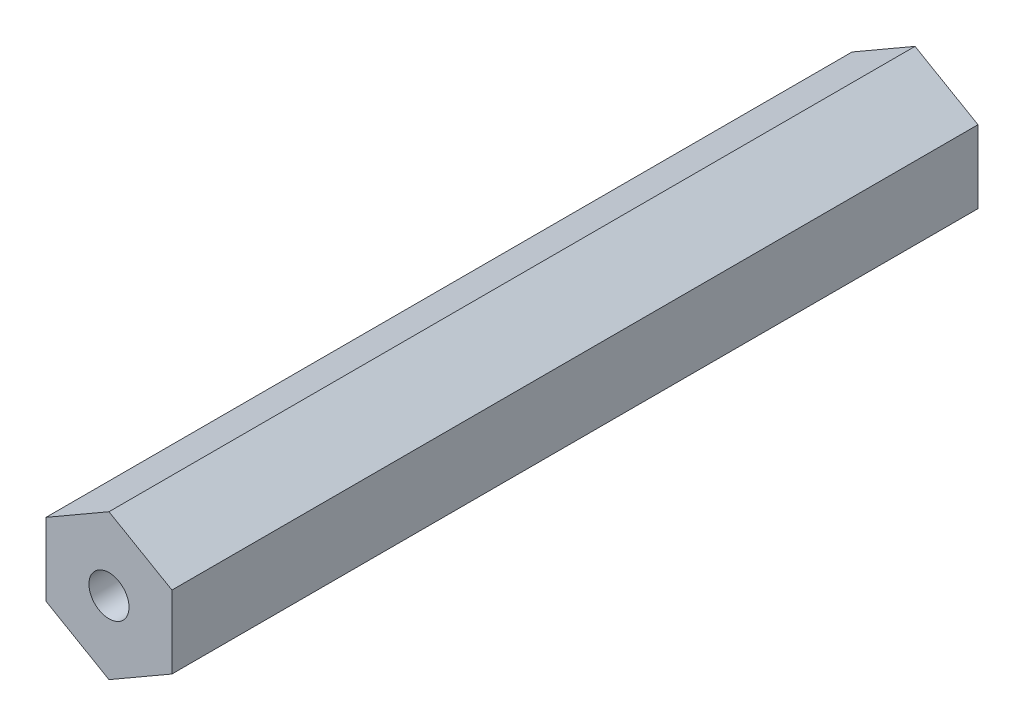
from build123d import *

# Parameters (mm, degrees)
BOSS_EXTRUDE1_DEPTH = 40.64
SKETCH2_R           = 2.0193
CUT_EXTRUDE1_DEPTH  = 82.856729921


with BuildPart() as part:
    # Sketch1 → Boss-Extrude1 (new, symmetric)
    with BuildSketch(Plane.XY):
        Polygon((0, 7.332348419), (-6.35, 3.666174209), (-6.35, -3.666174209), (0, -7.332348419), (6.35, -3.666174209), (6.35, 3.666174209), align=None)
    extrude(amount=BOSS_EXTRUDE1_DEPTH, both=True)

    # Sketch2 → Cut-Extrude1 (cut, through all)
    with BuildSketch(Plane(origin=(0, 0, -40.64), x_dir=(-1, 0, 0), z_dir=(0, 0, -1))):
        Circle(SKETCH2_R)
    extrude(amount=-CUT_EXTRUDE1_DEPTH, mode=Mode.SUBTRACT)


solid = part.part
